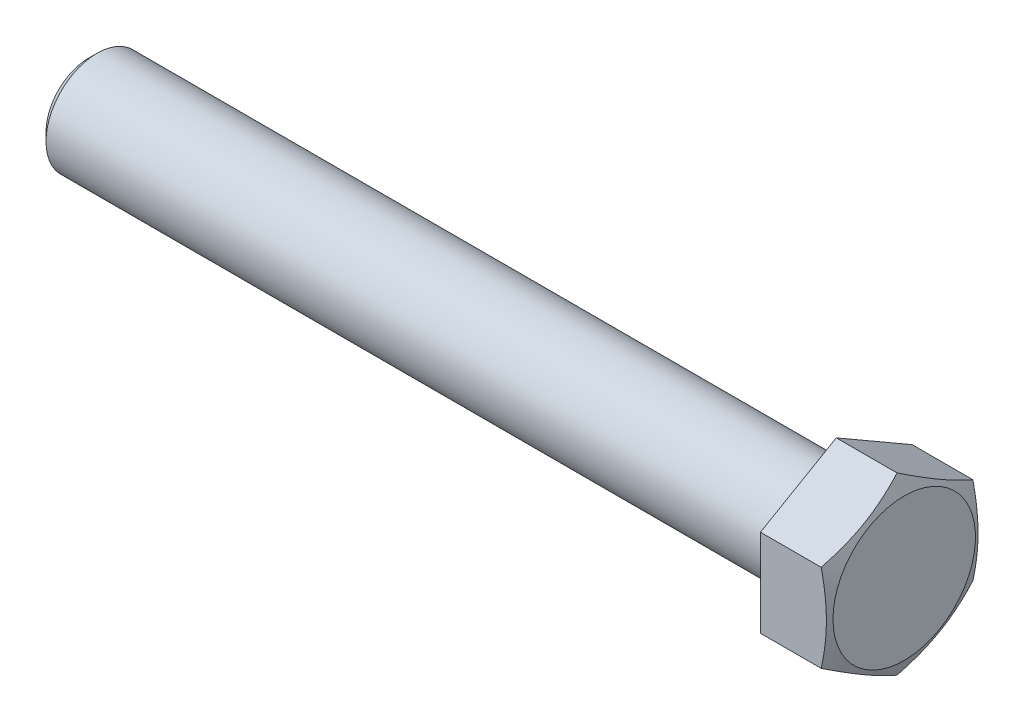
from build123d import *

# Parameters (mm, degrees)
HEX_HEAD_DEPTH  = 6.35
SKETCH3_R       = 4.7625
BOLT_BODY_DEPTH = 69.85
CHAMFER1_SIZE   = 0.762
FILLET1_R       = 0.381


with BuildPart() as part:
    # Sketch1 → HEX-HEAD (new body)
    with BuildSketch(Plane(origin=(0, 0, 0), x_dir=(0, 0, -1), z_dir=(1, 0, 0))):
        Polygon((0, 8.182900835), (-7.0866, 4.091450418), (-7.0866, -4.091450418), (0, -8.182900835), (7.0866, -4.091450418), (7.0866, 4.091450418), align=None)
    extrude(amount=HEX_HEAD_DEPTH)

    # Sketch2 → EDGE-CUT (revolve, cut)
    with BuildSketch(Plane.XY, mode=Mode.PRIVATE) as edge_cut_sk:
        Polygon((6.35, 6.658900835), (5.67731061, 8.182900835), (6.35, 8.182900835), align=None)
    revolve(edge_cut_sk.sketch.rotate(Axis((0, 0, 0), (1, 0, 0)), 90), axis=Axis((0, 0, 0), (1, 0, 0)), mode=Mode.SUBTRACT)

    # Sketch3 → BOLT-BODY (add)
    with BuildSketch(Plane.ZY):
        with Locations(Location((0, 0, 0), (0, 0, 180))):
            Circle(SKETCH3_R)
    extrude(amount=BOLT_BODY_DEPTH)

    # Chamfer1
    chamfer1_edges = [part.edges().sort_by_distance(p)[0] for p in [
        (-69.85, 0, 4.7625),
    ]]
    chamfer(chamfer1_edges, length=CHAMFER1_SIZE)

    # Fillet1
    fillet1_edges = [part.edges().sort_by_distance(p)[0] for p in [
        (0, 0, 4.7625),
    ]]
    fillet(fillet1_edges, radius=FILLET1_R)


solid = part.part
